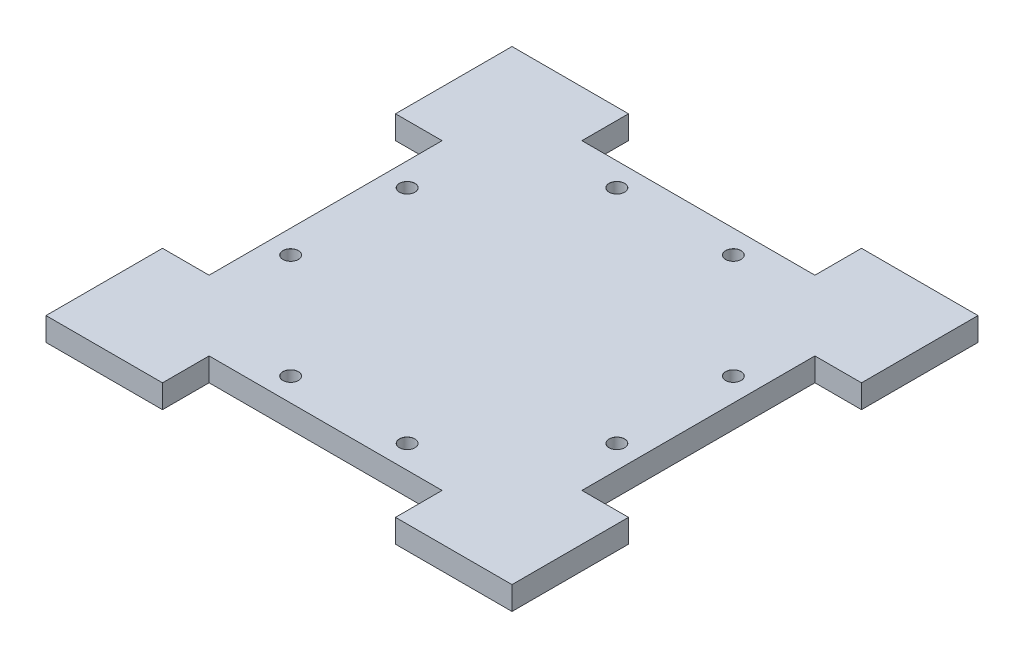
from build123d import *

# Parameters (mm, degrees)
BOSS_EXTRUDE1_DEPTH            = 10
M6_CLEARANCE_HOLE1_D           = 6.6
M6_CLEARANCE_HOLE1_CSINK_D     = 6.65
M6_CLEARANCE_HOLE1_CSINK_ANGLE = 100


with BuildPart() as part:
    # Sketch1 → Boss-Extrude1 (new body)
    with BuildSketch(Plane(origin=(0, 0, 0), x_dir=(1, 0, 0), z_dir=(0, 1, 0))):
        Polygon((-50, 80), (50, 80), (50, 100), (100, 100), (100, 50), (80, 50), (80, -50), (100, -50), (100, -100), (50, -100), (50, -80), (-50, -80), (-50, -100), (-100, -100), (-100, -50), (-80, -50), (-80, 50), (-100, 50), (-100, 100), (-50, 100), align=None)
    extrude(amount=BOSS_EXTRUDE1_DEPTH)

    # M6 Clearance Hole1 (through all)
    with Locations(Plane(origin=(0, 10, 0), x_dir=(1, 0, 0), z_dir=(0, 1, 0))):
        with Locations((-70, -25), (-70, 25), (-25, 70), (25, 70), (70, 25), (70, -25), (-25, -70), (25, -70)):
            CounterSinkHole(M6_CLEARANCE_HOLE1_D / 2, M6_CLEARANCE_HOLE1_CSINK_D / 2, counter_sink_angle=M6_CLEARANCE_HOLE1_CSINK_ANGLE)


solid = part.part
